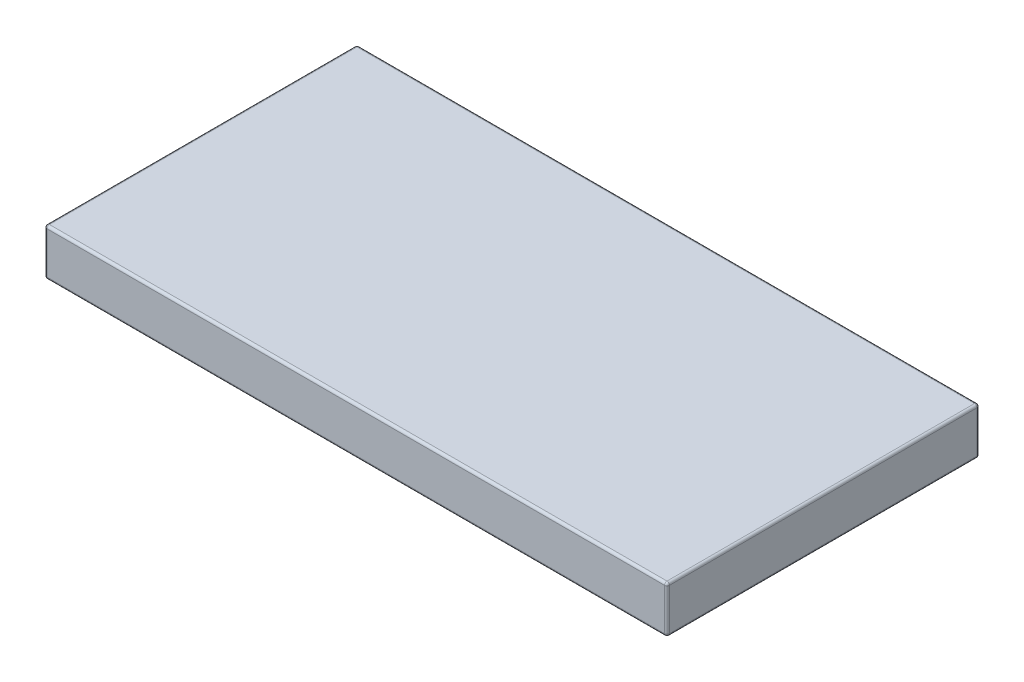
from build123d import *

# Parameters (mm, degrees)
SKETCH1_W           = 253
SKETCH1_H           = 127
BOSS_EXTRUDE1_DEPTH = 19
FILLET1_R           = 1


with BuildPart() as part:
    # Sketch1 → Boss-Extrude1 (new body)
    with BuildSketch(Plane(origin=(0, 0, 0), x_dir=(1, 0, 0), z_dir=(0, 1, 0))):
        with Locations((81.80887218, 45.132180451)):
            Rectangle(SKETCH1_W, SKETCH1_H)
    extrude(amount=BOSS_EXTRUDE1_DEPTH)

    # Fillet1
    fillet1_edges = [part.edges().sort_by_distance(p)[0] for p in [
        (208.30887218, 19, -45.132180451),
        (81.80887218, 19, -108.632180451),
        (-44.69112782, 19, -45.132180451),
        (81.80887218, 0, -108.632180451),
        (208.30887218, 0, -45.132180451),
        (81.80887218, 0, 18.367819549),
        (-44.69112782, 0, -45.132180451),
        (-44.69112782, 9.5, -108.632180451),
        (208.30887218, 9.5, -108.632180451),
        (208.30887218, 9.5, 18.367819549),
        (-44.69112782, 9.5, 18.367819549),
        (81.80887218, 19, 18.367819549),
    ]]
    fillet(fillet1_edges, radius=FILLET1_R)


solid = part.part
